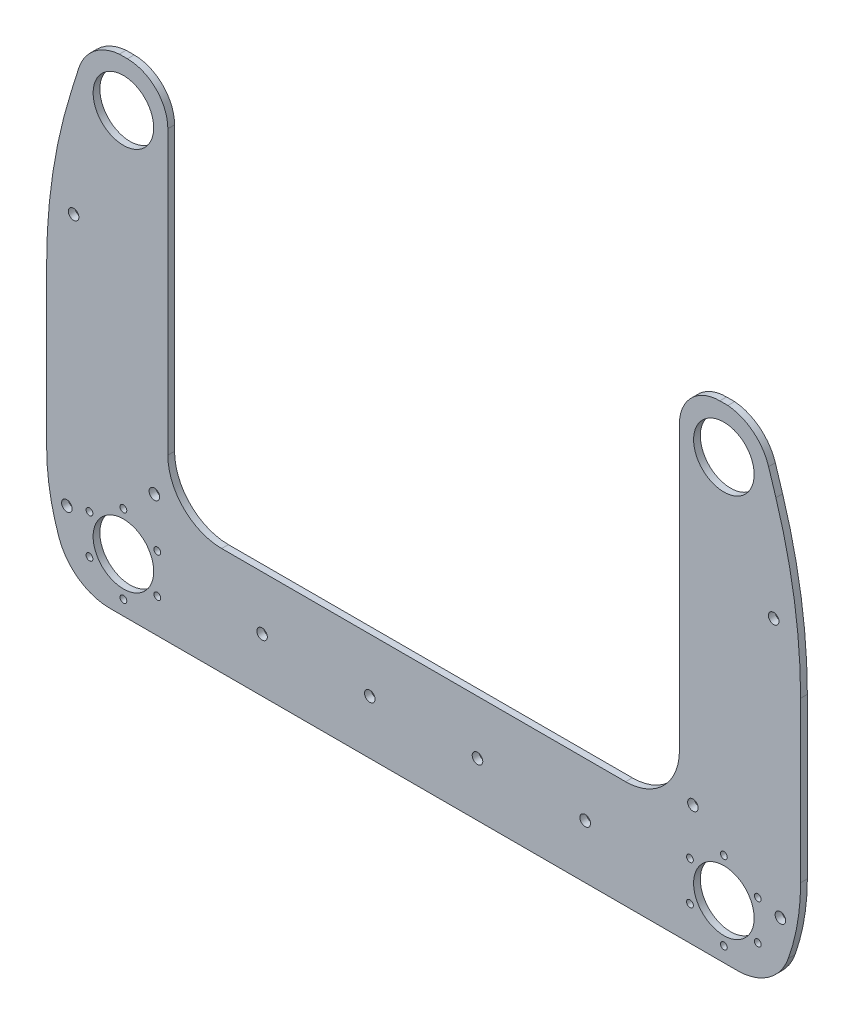
from build123d import *

# Parameters (mm, degrees)
SKETCH1_R           = 14.2875
SKETCH1_R_2         = 1.6002
SKETCH1_R_3         = 2.4892
BOSS_EXTRUDE3_DEPTH = 3.175
SKETCH2_W           = 355.6
SKETCH2_H           = 19.05
CUT_EXTRUDE1_DEPTH  = 290.621961572
FILLET1_R           = 19.05
CUT_EXTRUDE2_DEPTH  = 290.621961572
FILLET2_R           = 254
FILLET3_R           = 254
CUT_EXTRUDE3_DEPTH  = 290.621961572
FILLET4_R           = 25.4


with BuildPart() as part:
    # Sketch1 → Boss-Extrude3 (new body)
    with BuildSketch(Plane.XY):
        with BuildLine():
            Line((120.65, -152.4), (120.65, -6.35))
            Line((120.65, -6.35), (120.65, 6.35))
            ThreePointArc((120.65, 6.35), (124.369743879, 15.330256121), (133.35, 19.05))
            Line((133.35, 19.05), (165.1, 19.05))
            ThreePointArc((165.1, 19.05), (174.080256121, 15.330256121), (177.8, 6.35))
            Line((177.8, 6.35), (177.8, -6.35))
            Line((177.8, -6.35), (177.8, -222.25))
            ThreePointArc((177.8, -222.25), (175.940128061, -226.740128061), (171.45, -228.6))
            Line((171.45, -228.6), (12.7, -228.6))
            Line((12.7, -228.6), (-12.7, -228.6))
            Line((-12.7, -228.6), (-171.45, -228.6))
            ThreePointArc((-171.45, -228.6), (-175.940128061, -226.740128061), (-177.8, -222.25))
            Line((-177.8, -222.25), (-177.8, -6.35))
            Line((-177.8, -6.35), (-177.8, 6.35))
            ThreePointArc((-177.8, 6.35), (-174.080256121, 15.330256121), (-165.1, 19.05))
            Line((-165.1, 19.05), (-133.35, 19.05))
            ThreePointArc((-133.35, 19.05), (-124.369743879, 15.330256121), (-120.65, 6.35))
            Line((-120.65, 6.35), (-120.65, -6.35))
            Line((-120.65, -6.35), (-120.65, -152.4))
            ThreePointArc((-120.65, -152.4), (-113.210512242, -170.360512242), (-95.25, -177.8))
            Line((-95.25, -177.8), (-12.7, -177.8))
            Line((-12.7, -177.8), (12.7, -177.8))
            Line((12.7, -177.8), (95.25, -177.8))
            ThreePointArc((95.25, -177.8), (113.210512242, -170.360512242), (120.65, -152.4))
        make_face()
        with Locations((141.605, -22.02688)):
            Circle(SKETCH1_R, mode=Mode.SUBTRACT)
        with Locations(Location((-141.605, -22.02688, 0), (0, 0, 180))):
            Circle(SKETCH1_R, mode=Mode.SUBTRACT)
        with Locations((-141.605, -203.2)):
            Circle(SKETCH1_R, mode=Mode.SUBTRACT)
        with Locations((-141.605, -184.724802)):
            Circle(SKETCH1_R_2, mode=Mode.SUBTRACT)
        with Locations((-125.604004596, -193.962981004)):
            Circle(SKETCH1_R_2, mode=Mode.SUBTRACT)
        with Locations((-125.604004596, -212.439339011)):
            Circle(SKETCH1_R_2, mode=Mode.SUBTRACT)
        with Locations((-141.605, -221.677518015)):
            Circle(SKETCH1_R_2, mode=Mode.SUBTRACT)
        with Locations((-157.605995404, -212.439339011)):
            Circle(SKETCH1_R_2, mode=Mode.SUBTRACT)
        with Locations((-157.605995404, -193.962981004)):
            Circle(SKETCH1_R_2, mode=Mode.SUBTRACT)
        with Locations(Location((157.605995404, -212.439339011, 0), (0, 0, 180))):
            Circle(SKETCH1_R_2, mode=Mode.SUBTRACT)
        with Locations(Location((157.605995404, -193.962981004, 0), (0, 0, 180))):
            Circle(SKETCH1_R_2, mode=Mode.SUBTRACT)
        with Locations(Location((141.605, -184.724802, 0), (0, 0, 180))):
            Circle(SKETCH1_R_2, mode=Mode.SUBTRACT)
        with Locations(Location((125.604004596, -193.962981004, 0), (0, 0, 180))):
            Circle(SKETCH1_R_2, mode=Mode.SUBTRACT)
        with Locations(Location((125.604004596, -212.439339011, 0), (0, 0, 180))):
            Circle(SKETCH1_R_2, mode=Mode.SUBTRACT)
        with Locations(Location((141.605, -221.677518015, 0), (0, 0, 180))):
            Circle(SKETCH1_R_2, mode=Mode.SUBTRACT)
        with Locations(Location((141.605, -203.2, 0), (0, 0, 180))):
            Circle(SKETCH1_R, mode=Mode.SUBTRACT)
        with Locations((-76.2, -203.2)):
            Circle(SKETCH1_R_3, mode=Mode.SUBTRACT)
        with Locations(Location((76.2, -203.2, 0), (0, 0, 180))):
            Circle(SKETCH1_R_3, mode=Mode.SUBTRACT)
        with Locations((-25.4, -203.2)):
            Circle(SKETCH1_R_3, mode=Mode.SUBTRACT)
        with Locations((-127, -171.45)):
            Circle(SKETCH1_R_3, mode=Mode.SUBTRACT)
        with Locations((-149.225, 6.35)):
            Circle(SKETCH1_R_3, mode=Mode.SUBTRACT)
        with Locations(Location((127, -171.45, 0), (0, 0, 180))):
            Circle(SKETCH1_R_3, mode=Mode.SUBTRACT)
        with Locations(Location((149.225, 6.35, 0), (0, 0, 180))):
            Circle(SKETCH1_R_3, mode=Mode.SUBTRACT)
        with Locations((-168.275, -196.85)):
            Circle(SKETCH1_R_3, mode=Mode.SUBTRACT)
        with Locations(Location((168.275, -196.85, 0), (0, 0, 180))):
            Circle(SKETCH1_R_3, mode=Mode.SUBTRACT)
        with Locations((-165.1, -76.2)):
            Circle(SKETCH1_R_3, mode=Mode.SUBTRACT)
        with Locations(Location((165.1, -76.2, 0), (0, 0, 180))):
            Circle(SKETCH1_R_3, mode=Mode.SUBTRACT)
        with Locations(Location((25.4, -203.2, 0), (0, 0, 180))):
            Circle(SKETCH1_R_3, mode=Mode.SUBTRACT)
    extrude(amount=BOSS_EXTRUDE3_DEPTH)

    # Sketch2 → Cut-Extrude1 (cut, through all)
    with BuildSketch(Plane.XY.offset(3.175)):
        with Locations((0, 9.525)):
            Rectangle(SKETCH2_W, SKETCH2_H)
    extrude(amount=-CUT_EXTRUDE1_DEPTH, mode=Mode.SUBTRACT)

    # Fillet1
    fillet1_edges = [part.edges().sort_by_distance(p)[0] for p in [
        (-177.8, 0, 1.5875),
        (120.65, 0, 1.5875),
        (177.8, 0, 1.5875),
        (-120.65, 0, 1.5875),
    ]]
    fillet(fillet1_edges, radius=FILLET1_R)

    # Sketch3 → Cut-Extrude2 (cut, through all)
    with BuildSketch(Plane.XY.offset(3.175)):
        with BuildLine():
            Line((-177.8, 0), (-177.8, -63.5))
            Line((-177.8, -63.5), (-162.698792053, -15.403859213))
            ThreePointArc((-162.698792053, -15.403859213), (-155.445369527, -4.785747819), (-143.51, 0))
            Line((-143.51, 0), (-177.8, 0))
        make_face()
    cut_extrude2 = extrude(amount=-CUT_EXTRUDE2_DEPTH, mode=Mode.SUBTRACT)

    # Mirror1: Cut-Extrude2 across plane
    add(cut_extrude2.mirror(Plane(origin=(0, 0, 0), x_dir=(0, 0, 1), z_dir=(1, 0, 0))), mode=Mode.SUBTRACT)

    # Fillet2
    fillet2_edges = [part.edges().sort_by_distance(p)[0] for p in [
        (-177.8, -63.5, 1.5875),
    ]]
    fillet(fillet2_edges, radius=FILLET2_R)

    # Fillet3
    fillet3_edges = [part.edges().sort_by_distance(p)[0] for p in [
        (177.8, -63.5, 1.5875),
    ]]
    fillet(fillet3_edges, radius=FILLET3_R)

    # Sketch4 → Cut-Extrude3 (cut, through all)
    with BuildSketch(Plane.XY.offset(3.175)):
        with BuildLine():
            ThreePointArc((-164.188181024, -228.6), (-174.338063951, -204.096014982), (-177.8, -177.8))
            Line((-177.8, -177.8), (-177.8, -222.25))
            ThreePointArc((-177.8, -222.25), (-175.940128061, -226.740128061), (-171.45, -228.6))
            Line((-171.45, -228.6), (-164.188181024, -228.6))
        make_face()
        with BuildLine():
            ThreePointArc((177.8, -177.8), (174.338063951, -204.096014982), (164.188181024, -228.6))
            Line((164.188181024, -228.6), (171.45, -228.6))
            ThreePointArc((171.45, -228.6), (175.940128061, -226.740128061), (177.8, -222.25))
            Line((177.8, -222.25), (177.8, -177.8))
        make_face()
    extrude(amount=-CUT_EXTRUDE3_DEPTH, mode=Mode.SUBTRACT)

    # Fillet4
    fillet4_edges = [part.edges().sort_by_distance(p)[0] for p in [
        (-164.188181024, -228.6, 1.5875),
        (164.188181024, -228.6, 1.5875),
    ]]
    fillet(fillet4_edges, radius=FILLET4_R)


solid = part.part
